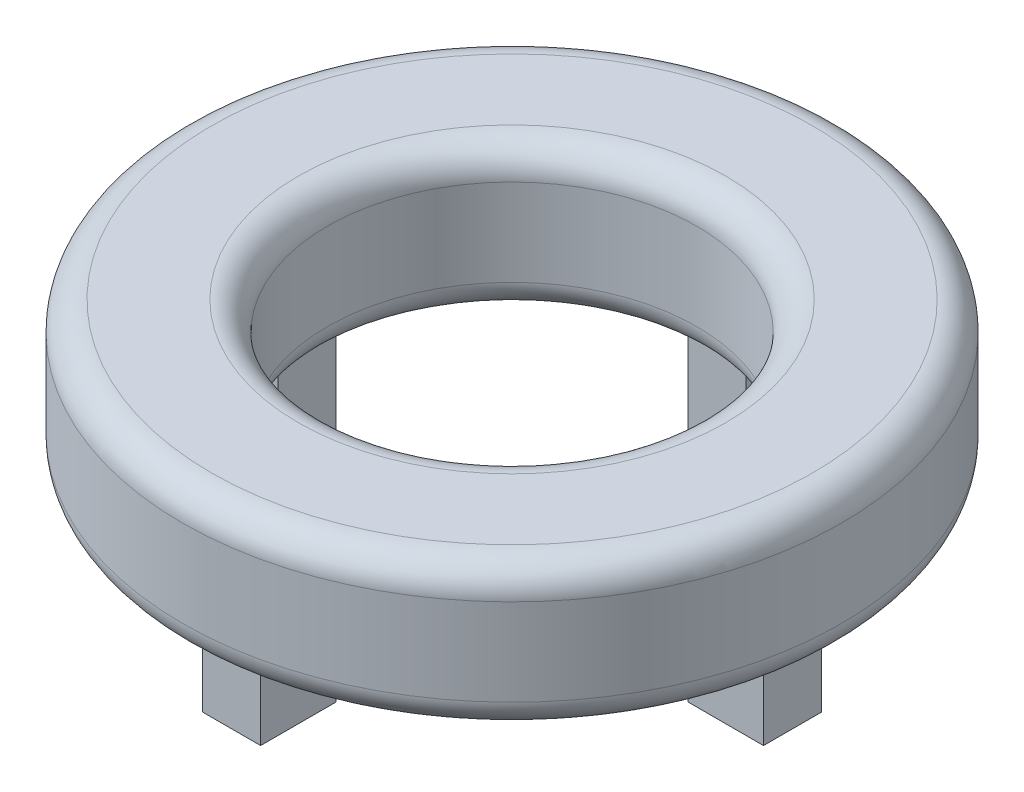
from build123d import *

# Parameters (mm, degrees)
SKETCH_1_R               = 56.885850613
SKETCH_1_R_2             = 31.885850613
EXTRUDE_1_DEPTH          = 25
FILLET_1_R               = 5
SKETCH_2_W               = 13
SKETCH_2_H               = 10
SKETCH_2_R               = 2.25
EXTRUDE_1_2_DEPTH        = 15
PATTERN_CIRCULAR_1_COUNT = 4


with BuildPart() as part:
    # Эскиз1 → Extrude 1 (new body)
    with BuildSketch(Plane(origin=(0, 0, 16.5), x_dir=(1, 0, 0), z_dir=(0, 1, 0))):
        with Locations((0, 16.5)):
            Circle(SKETCH_1_R)
        with Locations((0, 16.5)):
            Circle(SKETCH_1_R_2, mode=Mode.SUBTRACT)
    extrude(amount=EXTRUDE_1_DEPTH)

    # Скругление1
    fillet_1_edges = [part.edges().sort_by_distance(p)[0] for p in [
        (-56.885850613, 0, 0),
        (-56.885850613, 25, 0),
        (-31.885850613, 0, 0),
        (-31.885850613, 25, 0),
    ]]
    fillet(fillet_1_edges, radius=FILLET_1_R)

    # Эскиз2 → Extrude 1 2 (add)
    with BuildSketch(Plane.XZ):
        with Locations((-41.9, 0)):
            Rectangle(SKETCH_2_W, SKETCH_2_H)
        with Locations(Location((-41.9, 0, 0), (0, 0, 270))):
            Circle(SKETCH_2_R, mode=Mode.SUBTRACT)
    extrude_1_2 = extrude(amount=EXTRUDE_1_2_DEPTH)

    # Круговой массив1: Extrude 1 2 ×4 about axis
    pattern_circular_1_axis = Axis((0, 0, 0), (0, 1, 0))
    for i in range(1, PATTERN_CIRCULAR_1_COUNT):
        add(extrude_1_2.rotate(pattern_circular_1_axis, i * 360 / PATTERN_CIRCULAR_1_COUNT))


solid = part.part
